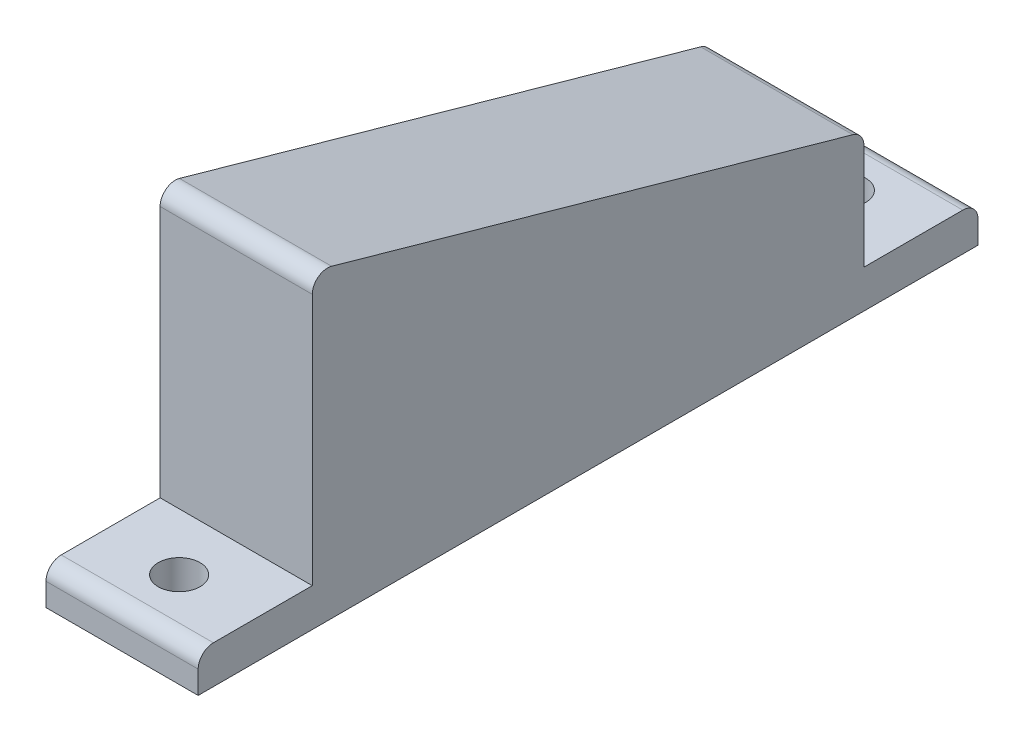
from build123d import *

# Parameters (mm, degrees)
EXTRUDE_1_DEPTH = 20
SKETCH_2_W      = 20
SKETCH_2_H      = 15
SKETCH_2_R      = 2.75
EXTRUDE_2_DEPTH = 5
FILLET_1_R      = 2


with BuildPart() as part:
    # 草图1 → 凸台-拉伸1 (new body)
    with BuildSketch(Plane(origin=(0, 0, 0), x_dir=(0, 0, -1), z_dir=(1, 0, 0))):
        Polygon((-38.386760485, 40.8), (-38.386760485, 0), (34.113239515, 0), (34.113239515, 20.4), align=None)
    extrude(amount=EXTRUDE_1_DEPTH)

    # 草图2 → 凸台-拉伸2 (add)
    # profile 1 of 2: a face of its own
    with BuildSketch(Plane.XZ):
        with Locations((10, 45.886760485)):
            Rectangle(SKETCH_2_W, SKETCH_2_H)
        with Locations(Location((10, 45.886760485, 0), (0, 0, 90))):
            Circle(SKETCH_2_R, mode=Mode.SUBTRACT)
    # profile 2 of 2: a face of its own
    with BuildSketch(Plane.XZ):
        with Locations((10, -41.613239515)):
            Rectangle(SKETCH_2_W, SKETCH_2_H)
        with Locations(Location((10, -41.613239515, 0), (0, 0, 270))):
            Circle(SKETCH_2_R, mode=Mode.SUBTRACT)
    extrude(amount=-EXTRUDE_2_DEPTH)

    # 圆角1
    fillet_1_edges = [part.edges().sort_by_distance(p)[0] for p in [
        (10, 5, 53.386760485),
        (10, 5, -49.113239515),
        (10, 20.4, -34.113239515),
        (10, 40.8, 38.386760485),
    ]]
    fillet(fillet_1_edges, radius=FILLET_1_R)


solid = part.part
